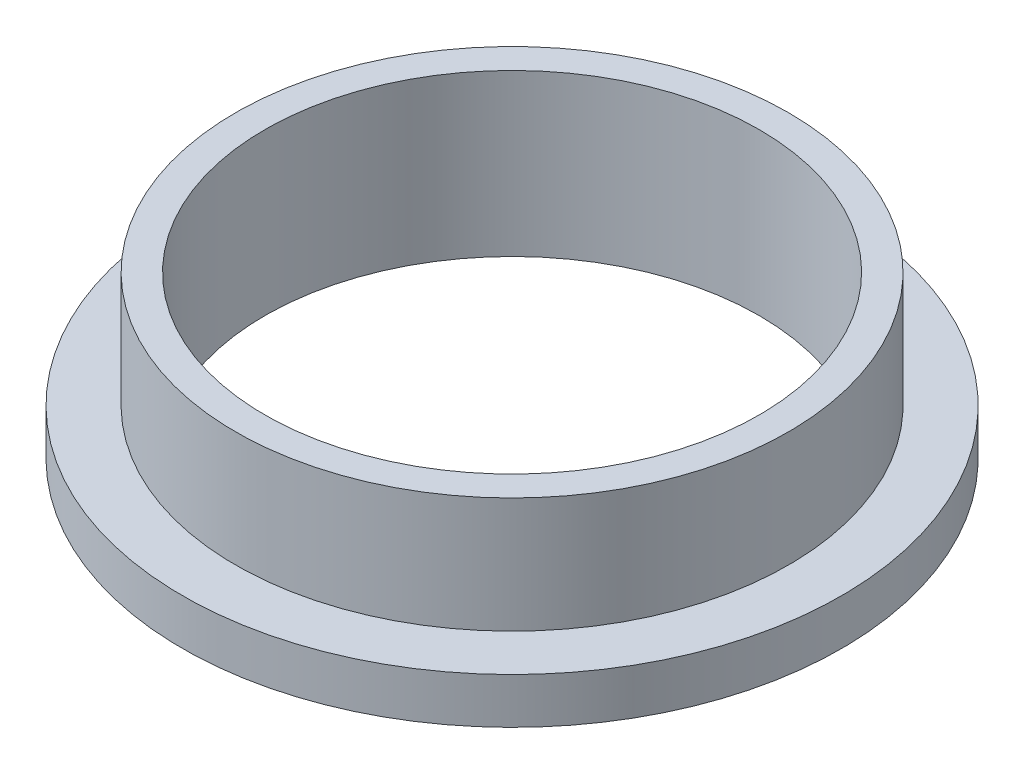
from build123d import *


with BuildPart() as part:
    # Sketch1 → Revolve1 (revolve)
    with BuildSketch(Plane(origin=(0, 0, 0), x_dir=(0, 0, -1), z_dir=(1, 0, 0))):
        Polygon((6.75, 0), (6.75, 4.4), (7.55, 4.4), (7.55, 1.25), (9, 1.25), (9, 0), align=None)
    revolve(axis=Axis((0, 0, 0), (0, 1, 0)))


solid = part.part
